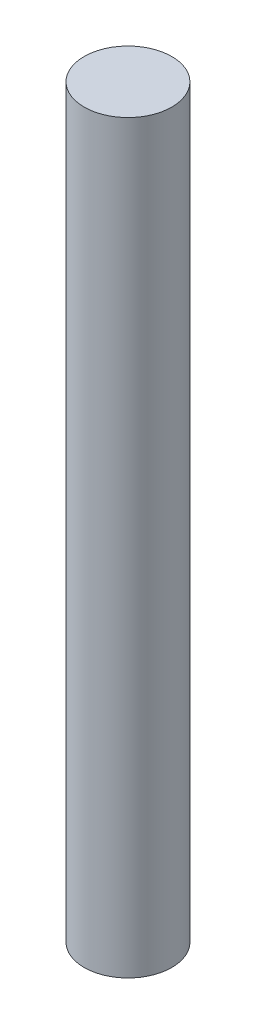
from build123d import *

# Parameters (mm, degrees)
CROQUIS1_R              = 5
SALIENTE_EXTRUIR1_DEPTH = 85


with BuildPart() as part:
    # Croquis1 → Saliente-Extruir1 (new body)
    with BuildSketch(Plane(origin=(0, 0, 0), x_dir=(1, 0, 0), z_dir=(0, 1, 0))):
        with Locations(Location((0, 0, 0), (0, 0, 270))):
            Circle(CROQUIS1_R)
    extrude(amount=SALIENTE_EXTRUIR1_DEPTH)


solid = part.part
